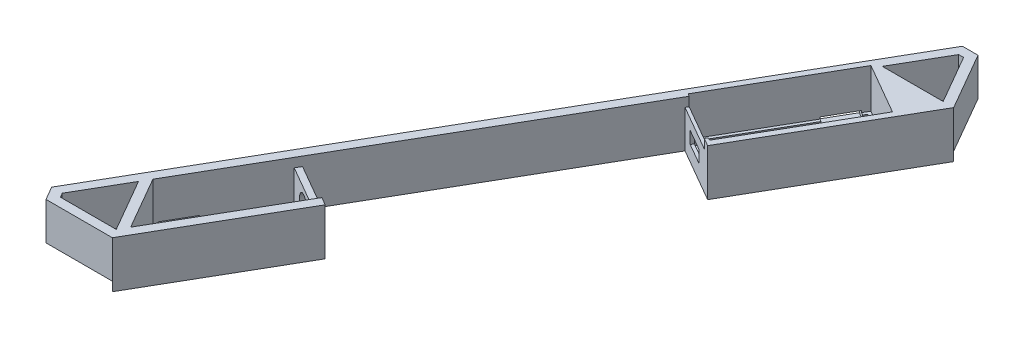
from build123d import *

# Parameters (mm, degrees)
BOSS_EXTRUDE2_DEPTH = 15.38
BOSS_EXTRUDE3_DEPTH = 1
BOSS_EXTRUDE4_DEPTH = 12.38
CUT_EXTRUDE1_DEPTH  = 8.26
SKETCH12_R          = 4
CUT_EXTRUDE2_DEPTH  = 8.26
CUT_EXTRUDE3_DEPTH  = 3
SKETCH16_W          = 10
SKETCH16_H          = 2
CUT_EXTRUDE4_DEPTH  = 3
CUT_EXTRUDE5_DEPTH  = 13


with BuildPart() as part:
    # Sketch1 → Boss-Extrude2 (new body)
    with BuildSketch(Plane(origin=(0, 0, 0), x_dir=(1, 0, 0), z_dir=(0, 1, 0))):
        Polygon((-33.232050802, 130.626242439), (-11.732050802, 167.865334802), (3.267949197, 159.205080764), (-18.232050803, 121.965988402), (-18.732050803, 121.099962998), (-16.133974592, 119.599962998), (13.464101619, 170.865334801), (2.556624332, 189.757639644), (-2.556624322, 189.757639644), (-112.11324865, 2e-09), (-109.556624323, -4.428203228), (-87.74166975, -4.428203228), (-62.14359354, 39.908965344), (-64.74166975, 41.408965344), (-65.74166975, 39.676914536), (-82.74166975, 10.232050807), (-87.74166975, 1.57179677), (-97.741669749, 18.892304845), (-80.741669749, 48.337168573), (-79.741669749, 50.069219381), (-33.732050802, 129.760217035), align=None)
        Polygon((-89.473720558, -1.42820323), (-107.824573519, -1.42820323), (-108.649147039, 0), (-99.473720558, 15.892304845), align=None, mode=Mode.SUBTRACT)
        Polygon((-9.999999996, 170.865334801), (-0.824573515, 186.757639646), (0.824573508, 186.757639646), (10.000000004, 170.865334801), align=None, mode=Mode.SUBTRACT)
    extrude(amount=BOSS_EXTRUDE2_DEPTH)

    # Sketch1<11> → Boss-Extrude3 (add)
    with BuildSketch(Plane(origin=(0, 0, 0), x_dir=(1, 0, 0), z_dir=(0, 1, 0))):
        Polygon((3.267949197, 159.205080764), (-11.732050802, 167.865334802), (-33.232050802, 130.626242439), (-18.232050803, 121.965988402), align=None)
        Polygon((-65.74166975, 39.676914536), (-80.741669749, 48.337168573), (-97.741669749, 18.892304845), (-87.74166975, 1.57179677), align=None)
    extrude(amount=BOSS_EXTRUDE3_DEPTH)

    # Sketch1<12> → Boss-Extrude4 (add)
    with BuildSketch(Plane(origin=(0, 0, 0), x_dir=(1, 0, 0), z_dir=(0, 1, 0))):
        Polygon((-18.232050803, 121.965988402), (-33.232050802, 130.626242439), (-33.732050802, 129.760217035), (-18.732050803, 121.099962998), align=None)
        Polygon((-64.74166975, 41.408965344), (-79.741669749, 50.069219381), (-80.741669749, 48.337168573), (-65.74166975, 39.676914536), align=None)
    extrude(amount=BOSS_EXTRUDE4_DEPTH)

    # Sketch10 → Cut-Extrude1 (cut)
    with BuildSketch(Plane(origin=(47.754809476, 0, -82.713756318), x_dir=(0.8660254037844418, 0, 0.49999999999999456), z_dir=(-0.4999999999999946, 0, 0.8660254037844419))):
        Polygon((-85.432921433, 5), (-81.432921433, 5), (-81.432921433, 9), (-89.432921433, 9), (-89.432921433, 5), align=None)
    extrude(amount=-CUT_EXTRUDE1_DEPTH, mode=Mode.SUBTRACT)

    # Sketch12 → Cut-Extrude2 (cut)
    with BuildSketch(Plane(origin=(1.745190528, 0, -3.022758664), x_dir=(-0.866025403784436, 0, -0.5000000000000047), z_dir=(0.5000000000000047, 0, -0.866025403784436))):
        with Locations((85.432921433, 6.5)):
            Circle(SKETCH12_R)
    extrude(amount=-CUT_EXTRUDE2_DEPTH, mode=Mode.SUBTRACT)

    # Sketch15 → Cut-Extrude3 (cut)
    with BuildSketch(Plane.XZ):
        Polygon((-87.74166975, 4.428203228), (-109.556624323, 4.428203228), (-112.11324865, -2e-09), (-101.205771363, -18.892304845), align=None)
        Polygon((13.464101619, -170.865334801), (2.556624332, -189.757639644), (-2.556624322, -189.757639644), (-13.464101609, -170.865334801), align=None)
    extrude(amount=-CUT_EXTRUDE3_DEPTH, mode=Mode.SUBTRACT)

    # Sketch16 → Cut-Extrude4 (cut)
    with BuildSketch(Plane(origin=(-84.084936489, 0, -48.546460716), x_dir=(-0.4999999999999999, 0, 0.8660254037844386), z_dir=(-0.8660254037844387, 0, -0.49999999999999994))):
        with Locations((-133.242624333, 2)):
            Rectangle(SKETCH16_W, SKETCH16_H)
        with Locations((26.242624323, 2)):
            Rectangle(SKETCH16_W, SKETCH16_H)
    extrude(amount=-CUT_EXTRUDE4_DEPTH, mode=Mode.SUBTRACT)

    # Sketch17 → Cut-Extrude5 (cut)
    with BuildSketch(Plane(origin=(0, 15.38, 0), x_dir=(1, 0, 0), z_dir=(0, 1, 0))):
        Polygon((-18.232050803, 121.965988402), (-17.366025399, 121.465988402), (4.633974601, 159.571106168), (-12.098076205, 169.231360205), (-34.098076205, 131.126242439), (-33.232050802, 130.626242439), align=None)
    extrude(amount=-CUT_EXTRUDE5_DEPTH, mode=Mode.SUBTRACT)


solid = part.part
